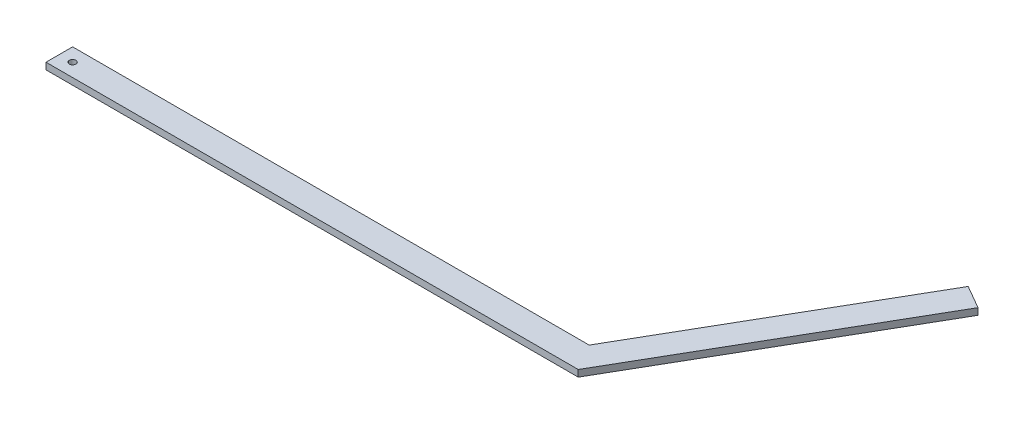
from build123d import *

# Parameters (mm, degrees)
BOSS_EXTRUDE1_DEPTH = 6.35
SKETCH2_R           = 3.175
CUT_EXTRUDE1_DEPTH  = 6.35


with BuildPart() as part:
    # Sketch1 → Boss-Extrude1 (new body)
    with BuildSketch(Plane(origin=(0, 0, 0), x_dir=(1, 0, 0), z_dir=(0, 1, 0))):
        Polygon((508, 0), (647.668283709, 241.91256359), (625.46262992, 254.733003782), (493.057158453, 25.4), (0, 25.4), (0, 0), align=None)
    extrude(amount=BOSS_EXTRUDE1_DEPTH)

    # Sketch2 → Cut-Extrude1 (cut)
    with BuildSketch(Plane(origin=(0, 6.35, 0), x_dir=(1, 0, 0), z_dir=(0, 1, 0))):
        with Locations(Location((12.7, 12.7, 0), (0, 0, 270))):
            Circle(SKETCH2_R)
    extrude(amount=-CUT_EXTRUDE1_DEPTH, mode=Mode.SUBTRACT)


solid = part.part
